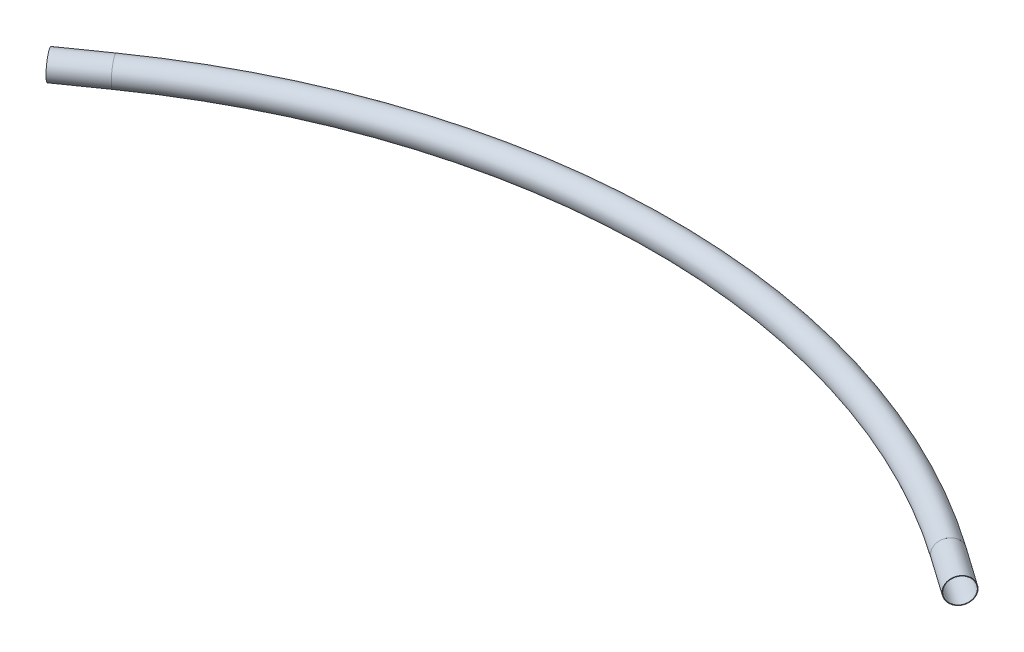
from build123d import *

# Parameters (mm, degrees)
SKETCH12_R                 = 84.1375
SKETCH12_R_2               = 80.7339
STRUCTURAL_MEMBER1_DEPTH   = 304.8
SKETCH12_ON_SEGMENT_2_R    = 84.1375
SKETCH12_ON_SEGMENT_2_R_2  = 80.7339
STRUCTURAL_MEMBER1_2_ANGLE = 70.179327101
SKETCH12_ON_SEGMENT_3_R    = 84.1375
SKETCH12_ON_SEGMENT_3_R_2  = 80.7339
STRUCTURAL_MEMBER1_3_DEPTH = 304.8


with BuildPart() as part:
    # Sketch12 → Structural Member1 (new body)
    with BuildSketch(Plane(origin=(2711.45, 0, 0), x_dir=(-0.5748576443252191, 0, 0.8182534379768044), z_dir=(-0.8182534379768044, 0, -0.5748576443252191))):
        Circle(SKETCH12_R)
        Circle(SKETCH12_R_2, mode=Mode.SUBTRACT)
    extrude(amount=-STRUCTURAL_MEMBER1_DEPTH)


with BuildPart() as body_2:
    # Sketch12 on segment 2 (carried to the start of arc 2) → Structural Member1 2 (revolve)
    with BuildSketch(Plane(origin=(2711.45, 0, 0), x_dir=(0.574857644, 0, -0.818253438), z_dir=(0.818253438, 0, 0.574857644))):
        Circle(SKETCH12_ON_SEGMENT_2_R)
        Circle(SKETCH12_ON_SEGMENT_2_R_2, mode=Mode.SUBTRACT)
    revolve(axis=Axis((0, 0, 3859.482962963), (0, 1, 0)), revolution_arc=STRUCTURAL_MEMBER1_2_ANGLE)


with BuildPart() as body_3:
    # Sketch12 on segment 3 (carried to segment 3) → Structural Member1 3 (new body)
    with BuildSketch(Plane(origin=(-2960.853647895, 0, 175.21660999), x_dir=(-0.574857644, 0, -0.818253438), z_dir=(0.818253438, 0, -0.574857644))):
        Circle(SKETCH12_ON_SEGMENT_3_R)
        Circle(SKETCH12_ON_SEGMENT_3_R_2, mode=Mode.SUBTRACT)
    extrude(amount=STRUCTURAL_MEMBER1_3_DEPTH)


solid = Compound([part.part, body_2.part, body_3.part])
